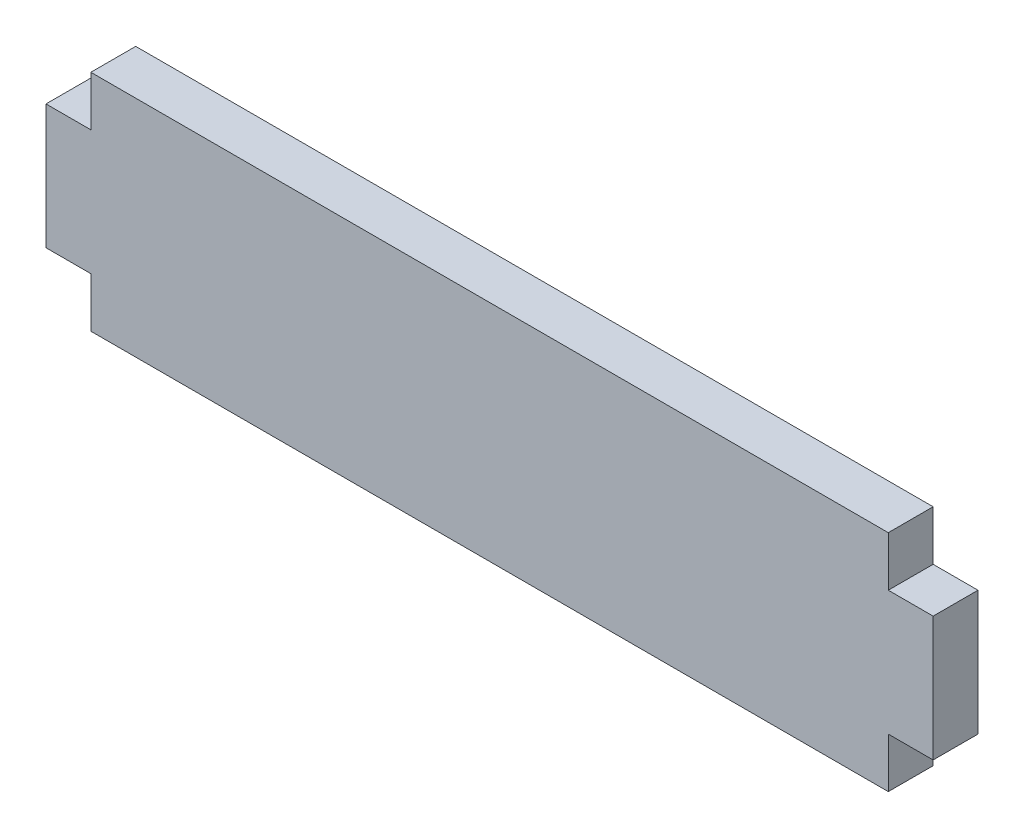
from build123d import *

# Parameters (mm, degrees)
BOSS_EXTRUDE1_DEPTH = 18


with BuildPart() as part:
    # Sketch1 → Boss-Extrude1 (new body)
    with BuildSketch(Plane.XY):
        Polygon((-160, 62.891566265), (160, 62.891566265), (160, 42.891566265), (178, 42.891566265), (178, -7.108433735), (160, -7.108433735), (160, -27.108433735), (-160, -27.108433735), (-160, -7.108433735), (-178, -7.108433735), (-178, 42.891566265), (-160, 42.891566265), align=None)
    extrude(amount=BOSS_EXTRUDE1_DEPTH)


solid = part.part
